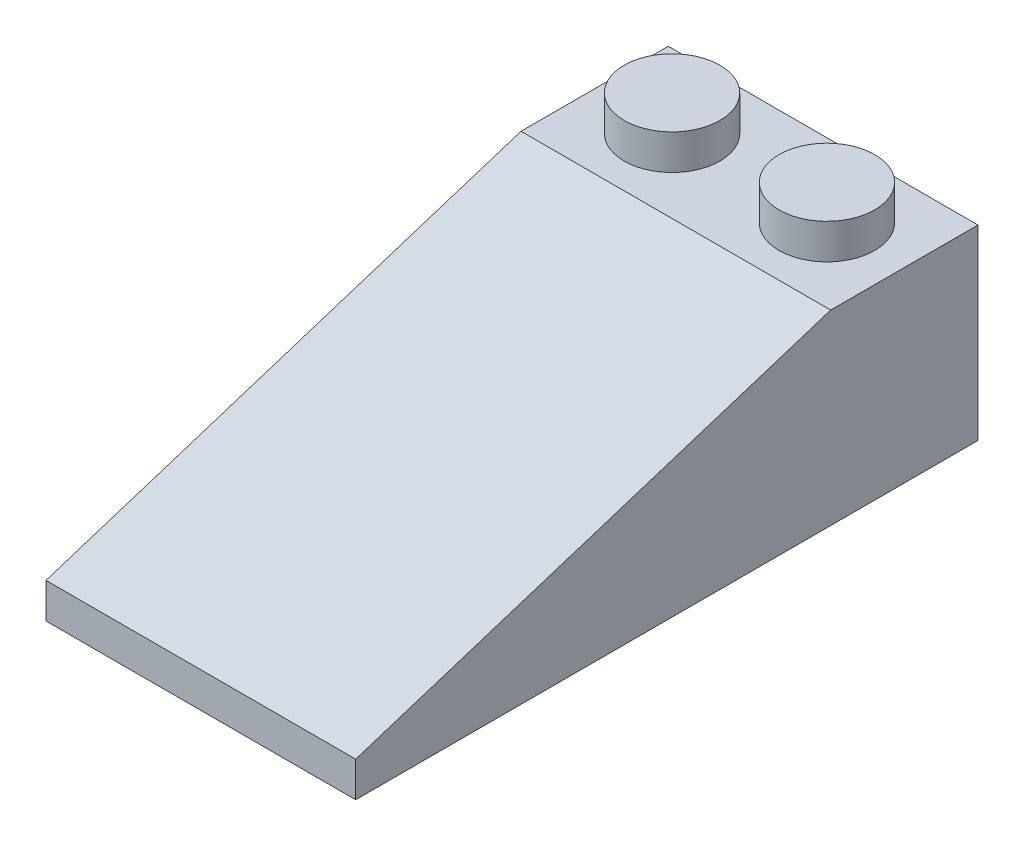
from build123d import *

# Parameters (mm, degrees)
BOSS_EXTRUDE1_DEPTH = 15.85
SKETCH3_R           = 2.45
BOSS_EXTRUDE2_DEPTH = 1.8
SHELL1_T            = -1.5
BOSS_EXTRUDE3_REACH = 39.343
SKETCH4_R           = 3.25
SKETCH4_R_2         = 2.45


with BuildPart() as part:
    # Sketch2 → Boss-Extrude1 (new body)
    with BuildSketch(Plane(origin=(0, 0, 0), x_dir=(0, 0, -1), z_dir=(1, 0, 0))):
        Polygon((0, 0), (-31.85, 0), (-31.85, 1.8), (-7.54, 9.55), (0, 9.55), align=None)
    extrude(amount=-BOSS_EXTRUDE1_DEPTH)

    # Sketch3 → Boss-Extrude2 (add)
    with BuildSketch(Plane(origin=(0, 9.55, 0), x_dir=(1, 0, 0), z_dir=(0, 1, 0))):
        with Locations(Location((-11.8875, -3.77, 0), (0, 0, 270))):
            Circle(SKETCH3_R)
        with Locations(Location((-3.9625, -3.77, 0), (0, 0, 270))):
            Circle(SKETCH3_R)
    extrude(amount=BOSS_EXTRUDE2_DEPTH)

    # Shell1
    shell1_openings = [part.faces().sort_by_distance(p)[0] for p in [
        (-7.925, 0, 15.925),
    ]]
    offset(amount=SHELL1_T, openings=shell1_openings, kind=Kind.INTERSECTION)

    # Boss-Extrude3: up to this plane
    boss_extrude3_end = Plane(origin=(-15.85, 0.370866339, 31.394393835), z_dir=(0, 0.952755774285987, 0.30373744346838355))
    # Sketch4 → Boss-Extrude3 (add, up to the surface)
    with BuildSketch(Plane(origin=(0, 0, 0), x_dir=(1, 0, 0), z_dir=(0, 1, 0)), mode=Mode.PRIVATE) as boss_extrude3_sk1:
        with Locations(Location((-7.925, -23.8875, 0), (0, 0, 270))):
            Circle(SKETCH4_R)
        with Locations(Location((-7.925, -23.8875, 0), (0, 0, 270))):
            Circle(SKETCH4_R_2, mode=Mode.SUBTRACT)
    boss_extrude3_tool1 = split(extrude(boss_extrude3_sk1.sketch, amount=BOSS_EXTRUDE3_REACH, mode=Mode.PRIVATE), bisect_by=boss_extrude3_end, keep=Keep.BOTH, mode=Mode.PRIVATE)
    add(boss_extrude3_tool1.solids().sort_by_distance((-7.925, 0, 20.729424))[0])
    # Sketch4 → Boss-Extrude3 (add, up to the surface)
    with BuildSketch(Plane(origin=(0, 0, 0), x_dir=(1, 0, 0), z_dir=(0, 1, 0)), mode=Mode.PRIVATE) as boss_extrude3_sk2:
        with Locations(Location((-7.925, -15.925, 0), (0, 0, 270))):
            Circle(SKETCH4_R)
        with Locations(Location((-7.925, -15.925, 0), (0, 0, 270))):
            Circle(SKETCH4_R_2, mode=Mode.SUBTRACT)
    boss_extrude3_tool2 = split(extrude(boss_extrude3_sk2.sketch, amount=BOSS_EXTRUDE3_REACH, mode=Mode.PRIVATE), bisect_by=boss_extrude3_end, keep=Keep.BOTH, mode=Mode.PRIVATE)
    add(boss_extrude3_tool2.solids().sort_by_distance((-7.925, 0, 12.766924))[0])
    # Sketch4 → Boss-Extrude3 (add, up to the surface)
    with BuildSketch(Plane(origin=(0, 0, 0), x_dir=(1, 0, 0), z_dir=(0, 1, 0)), mode=Mode.PRIVATE) as boss_extrude3_sk3:
        with Locations(Location((-7.925, -7.9625, 0), (0, 0, 11.641598249))):
            Circle(SKETCH4_R)
        with Locations(Location((-7.925, -7.9625, 0), (0, 0, 15.526222554))):
            Circle(SKETCH4_R_2, mode=Mode.SUBTRACT)
    boss_extrude3_tool3 = split(extrude(boss_extrude3_sk3.sketch, amount=BOSS_EXTRUDE3_REACH, mode=Mode.PRIVATE), bisect_by=boss_extrude3_end, keep=Keep.BOTH, mode=Mode.PRIVATE)
    add(boss_extrude3_tool3.solids().sort_by_distance((-11.018111, 0, 8.599765))[0])


solid = part.part
